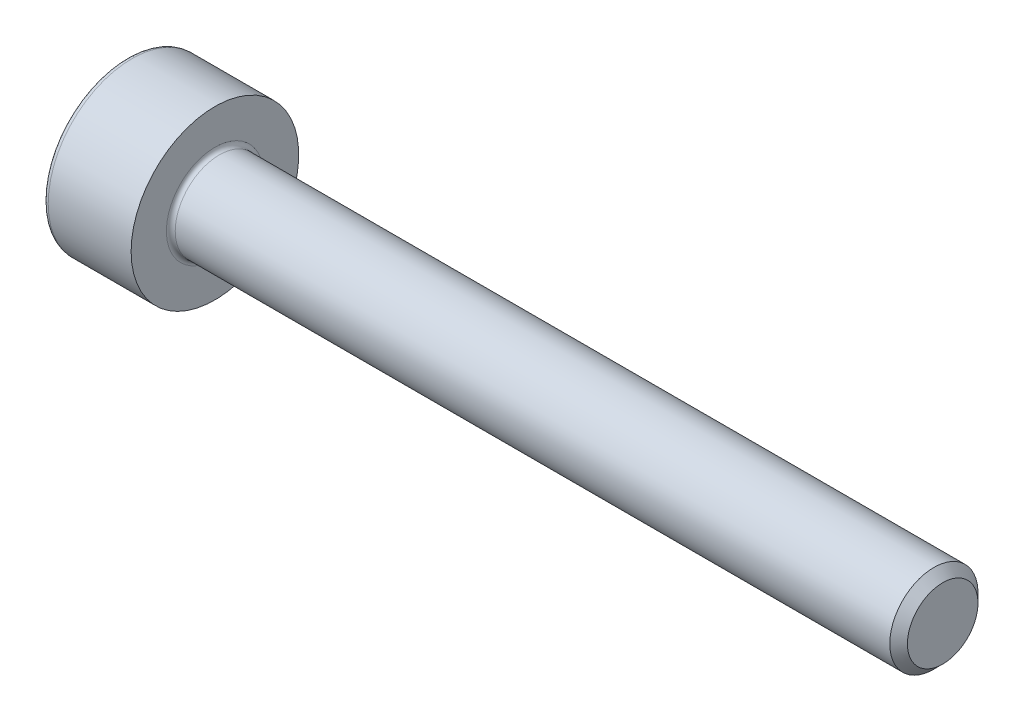
from build123d import *

# Parameters (mm, degrees)
FILLET1_R      = 0.1
FILLET2_R      = 0.12
CHAMFER1_SIZE  = 0.2
EXTRUDE1_DEPTH = 1


with BuildPart() as part:
    # Sketch1 → Revolve1 (revolve)
    with BuildSketch(Plane.XY, mode=Mode.PRIVATE) as revolve1_sk:
        Polygon((2, 1), (2, 0), (4.279914881, 0), (18.5, 0), (18.5, 1), align=None)
        Polygon((0, 1.9), (0, 0), (2, 0), (2, 1), (2, 1.9), align=None)
    revolve(revolve1_sk.sketch.rotate(Axis((0, 0, 0), (1, 0, 0)), 90), axis=Axis((0, 0, 0), (1, 0, 0)))

    # Fillet1
    fillet1_edges = [part.edges().sort_by_distance(p)[0] for p in [
        (2, 0, -1),
    ]]
    fillet(fillet1_edges, radius=FILLET1_R)

    # Fillet2
    fillet2_edges = [part.edges().sort_by_distance(p)[0] for p in [
        (0, 0, -1.9),
    ]]
    fillet(fillet2_edges, radius=FILLET2_R)

    # Chamfer1
    chamfer1_edges = [part.edges().sort_by_distance(p)[0] for p in [
        (18.5, 0, -1),
    ]]
    chamfer(chamfer1_edges, length=CHAMFER1_SIZE)

    # Sketch2 → Extrude1 (cut)
    with BuildSketch(Plane.ZY):
        Polygon((0, 0.866025404), (-0.75, 0.433012702), (-0.75, -0.433012702), (0, -0.866025404), (0.75, -0.433012702), (0.75, 0.433012702), align=None)
    extrude(amount=-EXTRUDE1_DEPTH, mode=Mode.SUBTRACT)


solid = part.part
